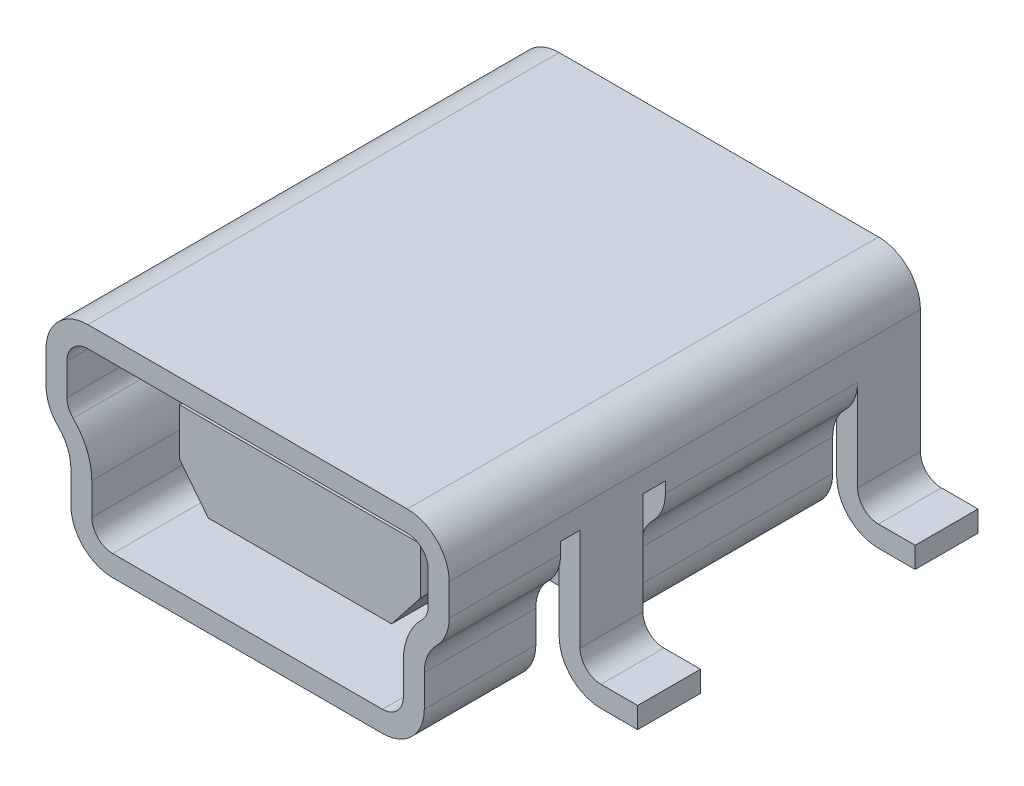
from build123d import *

# Parameters (mm, degrees)
BODY_START       = 6.4
BODY_DEPTH       = 9
SKETCH2_W        = 2.5
SKETCH2_H        = 2
SKETCH2_W_2      = 7.7
SKETCH2_H_2      = 3.5
BODYCUT_DEPTH    = 2.75
FOOT1_DEPTH      = 0.6
FOOT2_DEPTH      = 0.6
CORE1_DEPTH      = 2.3
CORE2_DEPTH      = 4.5
SKETCH9_R        = 0.4
LOCATEPINS_DEPTH = 0.5


with BuildPart() as part:
    # Sketch1 → Body (new body)
    with BuildSketch(Plane.XY.offset(BODY_START)):
        with BuildLine():
            ThreePointArc((3.6125, 1.975), (3.788241153, 2.235632313), (3.85, 2.543853013))
            Line((3.85, 2.543853013), (3.85, 3.15))
            ThreePointArc((3.85, 3.15), (3.615685425, 3.715685425), (3.05, 3.95))
            Line((3.05, 3.95), (-3.05, 3.95))
            ThreePointArc((-3.05, 3.95), (-3.615685425, 3.715685425), (-3.85, 3.15))
            Line((-3.85, 3.15), (-3.85, 2.543853013))
            ThreePointArc((-3.85, 2.543853013), (-3.788241153, 2.235632313), (-3.6125, 1.975))
            ThreePointArc((-3.6125, 1.975), (-3.436758847, 1.714367687), (-3.375, 1.406146987))
            Line((-3.375, 1.406146987), (-3.375, 0.8))
            ThreePointArc((-3.375, 0.8), (-3.140685425, 0.234314575), (-2.575, 0))
            Line((-2.575, 0), (2.575, 0))
            ThreePointArc((2.575, 0), (3.140685425, 0.234314575), (3.375, 0.8))
            Line((3.375, 0.8), (3.375, 1.406146987))
            ThreePointArc((3.375, 1.406146987), (3.436758847, 1.714367687), (3.6125, 1.975))
        make_face()
        with BuildLine():
            ThreePointArc((3.33125, 2.259426506), (3.419120577, 2.389742663), (3.45, 2.543853013))
            Line((3.45, 2.543853013), (3.45, 3.15))
            ThreePointArc((3.45, 3.15), (3.332842712, 3.432842712), (3.05, 3.55))
            Line((3.05, 3.55), (-3.05, 3.55))
            ThreePointArc((-3.05, 3.55), (-3.332842712, 3.432842712), (-3.45, 3.15))
            Line((-3.45, 3.15), (-3.45, 2.543853013))
            ThreePointArc((-3.45, 2.543853013), (-3.419120577, 2.389742663), (-3.33125, 2.259426506))
            ThreePointArc((-3.33125, 2.259426506), (-3.06763827, 1.868478038), (-2.975, 1.406146987))
            Line((-2.975, 1.406146987), (-2.975, 0.8))
            ThreePointArc((-2.975, 0.8), (-2.857842712, 0.517157288), (-2.575, 0.4))
            Line((-2.575, 0.4), (2.575, 0.4))
            ThreePointArc((2.575, 0.4), (2.857842712, 0.517157288), (2.975, 0.8))
            Line((2.975, 0.8), (2.975, 1.406146987))
            ThreePointArc((2.975, 1.406146987), (3.06763827, 1.868478038), (3.33125, 2.259426506))
        make_face(mode=Mode.SUBTRACT)
    extrude(amount=-BODY_DEPTH)

    # Sketch2 → BodyCut (cut)
    with BuildSketch(Plane.XZ):
        with Locations((2.6, 3.27)):
            Rectangle(SKETCH2_W, SKETCH2_H)
        with Locations((0, -0.85)):
            Rectangle(SKETCH2_W_2, SKETCH2_H_2)
        with Locations((-2.6, 3.27)):
            Rectangle(SKETCH2_W, SKETCH2_H)
    extrude(amount=-BODYCUT_DEPTH, mode=Mode.SUBTRACT)

    # Sketch3 → Foot1 (add, symmetric)
    with BuildSketch(Plane.XY.offset(-2)):
        with BuildLine():
            Line((-3.45, 2.75), (-3.45, 0.8))
            ThreePointArc((-3.45, 0.8), (-3.684314575, 0.234314575), (-4.25, 0))
            Line((-4.25, 0), (-4.95, 0))
            Line((-4.95, 0), (-4.95, 0.4))
            Line((-4.95, 0.4), (-4.25, 0.4))
            ThreePointArc((-4.25, 0.4), (-3.967157288, 0.517157288), (-3.85, 0.8))
            Line((-3.85, 0.8), (-3.85, 2.75))
            Line((-3.85, 2.75), (-3.45, 2.75))
        make_face()
    foot1 = extrude(amount=FOOT1_DEPTH, both=True)

    # Sketch4 → Foot2 (add, symmetric)
    with BuildSketch(Plane.XY.offset(3.3)):
        with BuildLine():
            Line((-3.45, 2.75), (-3.45, 0.8))
            ThreePointArc((-3.45, 0.8), (-3.684314575, 0.234314575), (-4.25, 0))
            Line((-4.25, 0), (-4.95, 0))
            Line((-4.95, 0), (-4.95, 0.4))
            Line((-4.95, 0.4), (-4.25, 0.4))
            ThreePointArc((-4.25, 0.4), (-3.967157288, 0.517157288), (-3.85, 0.8))
            Line((-3.85, 0.8), (-3.85, 2.75))
            Line((-3.85, 2.75), (-3.45, 2.75))
        make_face()
    foot2 = extrude(amount=FOOT2_DEPTH, both=True)

    # Mirror1: Foot1, Foot2 across plane
    add(foot1.mirror(Plane(origin=(0, 0, 0), x_dir=(0, 0, 1), z_dir=(1, 0, 0))))
    add(foot2.mirror(Plane(origin=(0, 0, 0), x_dir=(0, 0, 1), z_dir=(1, 0, 0))))

    # Sketch6 → Core1 (add)
    with BuildSketch(Plane(origin=(0, 0, 0.9), x_dir=(-1, 0, 0), z_dir=(0, 0, -1))):
        with BuildLine():
            Line((3.45, 3.15), (3.45, 2.75))
            Line((3.45, 2.75), (3.85, 2.75))
            Line((3.85, 2.75), (3.85, 2.543853013))
            ThreePointArc((3.85, 2.543853013), (3.788241153, 2.235632313), (3.6125, 1.975))
            ThreePointArc((3.6125, 1.975), (3.436758847, 1.714367687), (3.375, 1.406146987))
            Line((3.375, 1.406146987), (3.375, 0.8))
            ThreePointArc((3.375, 0.8), (3.140685425, 0.234314575), (2.575, 0))
            Line((2.575, 0), (-2.575, 0))
            ThreePointArc((-2.575, 0), (-3.140685425, 0.234314575), (-3.375, 0.8))
            Line((-3.375, 0.8), (-3.375, 1.406146987))
            ThreePointArc((-3.375, 1.406146987), (-3.436758847, 1.714367687), (-3.6125, 1.975))
            ThreePointArc((-3.6125, 1.975), (-3.788241153, 2.235632313), (-3.85, 2.543853013))
            Line((-3.85, 2.543853013), (-3.85, 2.75))
            Line((-3.85, 2.75), (-3.45, 2.75))
            Line((-3.45, 2.75), (-3.45, 3.15))
            ThreePointArc((-3.45, 3.15), (-3.332842712, 3.432842712), (-3.05, 3.55))
            Line((-3.05, 3.55), (3.05, 3.55))
            ThreePointArc((3.05, 3.55), (3.332842712, 3.432842712), (3.45, 3.15))
        make_face()
    extrude(amount=CORE1_DEPTH)

    # Sketch7 → Core2 (add)
    with BuildSketch(Plane.XY.offset(0.9)):
        Polygon((-2.3, 2.5), (2.3, 2.5), (2.3, 1.6), (1.75, 0.9), (-1.75, 0.9), (-2.3, 1.6), align=None)
    extrude(amount=CORE2_DEPTH)

    # Sketch9 → LocatePins (add)
    with BuildSketch(Plane.XZ):
        with Locations(Location((-1.75, 0, 0), (0, 0, 270))):
            Circle(SKETCH9_R)
        with Locations(Location((1.75, 0, 0), (0, 0, 90))):
            Circle(SKETCH9_R)
    extrude(amount=LOCATEPINS_DEPTH)


solid = part.part
